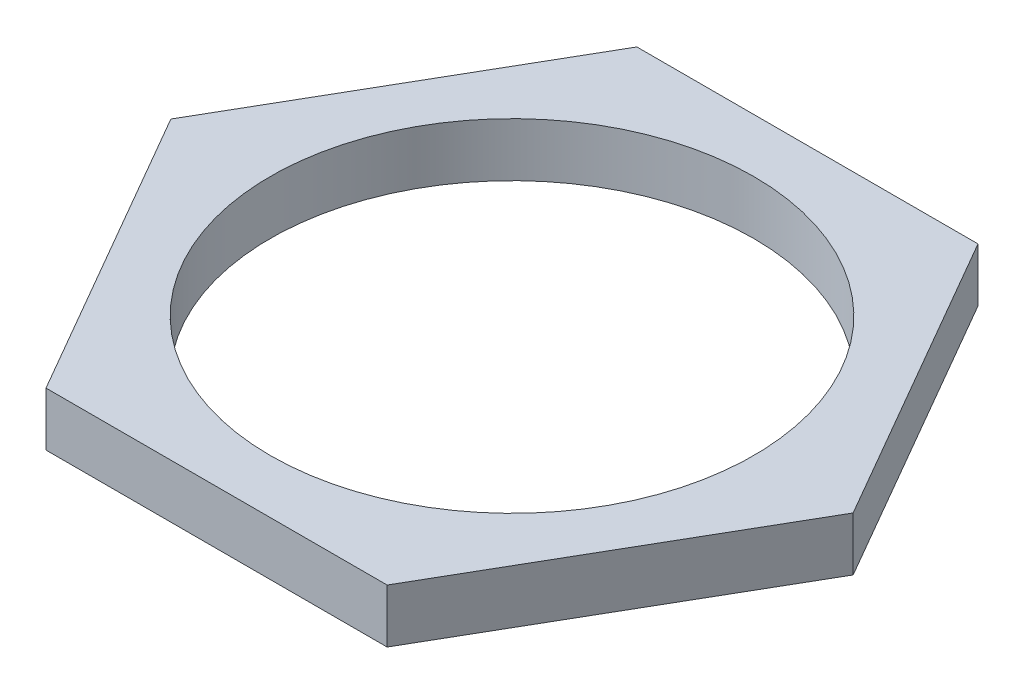
from build123d import *

# Parameters (mm, degrees)
SKETCH1_R           = 9
BOSS_EXTRUDE1_DEPTH = 2


with BuildPart() as part:
    # Sketch1 → Boss-Extrude1 (new body)
    with BuildSketch(Plane(origin=(0, 0, 0), x_dir=(1, 0, 0), z_dir=(0, 1, 0))):
        Polygon((6.350852961, -11), (12.701705922, 0), (6.350852961, 11), (-6.350852961, 11), (-12.701705922, 0), (-6.350852961, -11), align=None)
        with Locations(Location((0, 0, 0), (0, 0, 270))):
            Circle(SKETCH1_R, mode=Mode.SUBTRACT)
    extrude(amount=BOSS_EXTRUDE1_DEPTH)


solid = part.part
